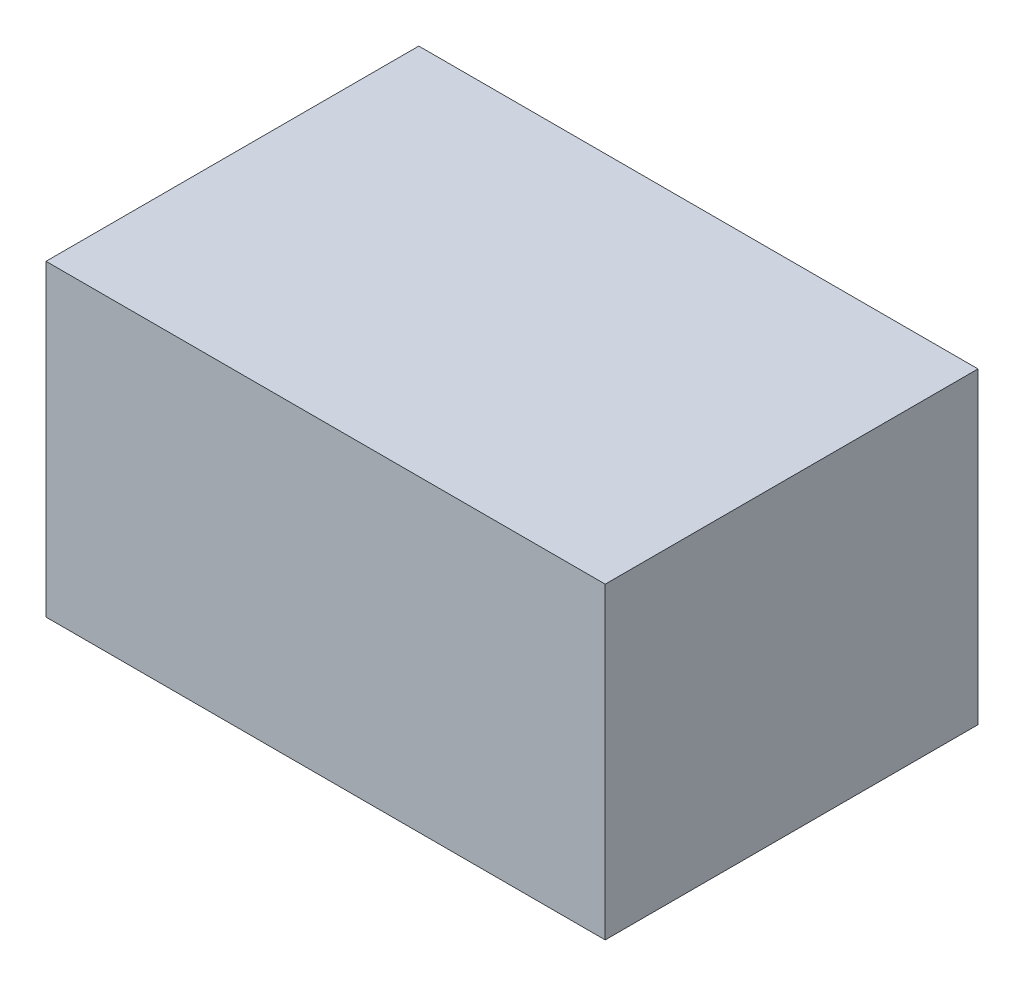
from build123d import *

# Parameters (mm, degrees)
SKETCH2_W           = 300
SKETCH2_H           = 165.306770026
BOSS_EXTRUDE1_DEPTH = 200


with BuildPart() as part:
    # Sketch2 → Boss-Extrude1 (new body)
    with BuildSketch(Plane.XY):
        Rectangle(SKETCH2_W, SKETCH2_H)
    extrude(amount=BOSS_EXTRUDE1_DEPTH)


solid = part.part
